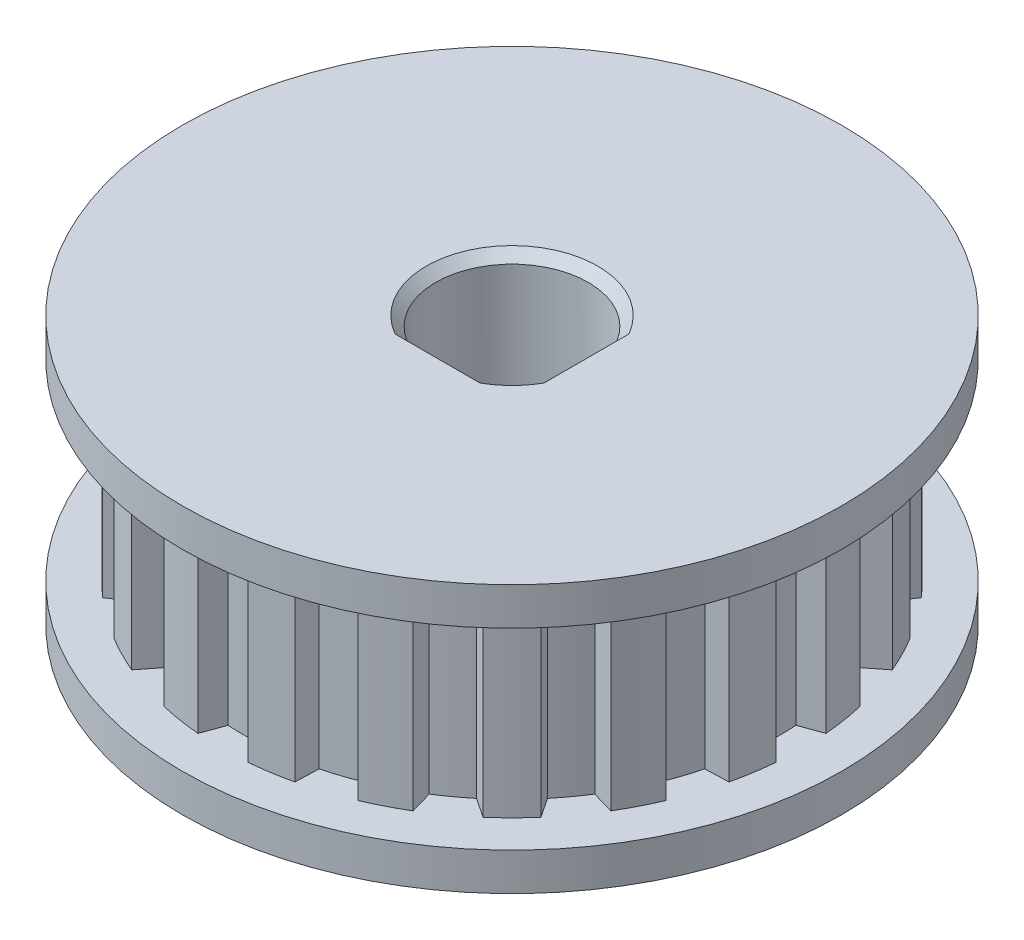
from build123d import *

# Parameters (mm, degrees)
EXTRUDE_1_DEPTH     = 10.2
SKETCH_3_R          = 17.5
EXTRUDE_2_DEPTH     = 2
EXTRUDE_START       = 2
SKETCH_4_R          = 17.5
EXTRUDE_3_DEPTH     = 2
CUT_EXTRUDE_4_DEPTH = 10
CUT_EXTRUDE_START   = -4.2
SKETCH_6_R          = 4.05
CUT_EXTRUDE_5_DEPTH = 4.2
CHAMFER_1_SIZE      = 0.5
CHAMFER_2_SIZE      = 0.5


with BuildPart() as part:
    # Эскиз2 → Вытянуть1 (new body)
    with BuildSketch(Plane(origin=(0, 0, 0), x_dir=(1, 0, 0), z_dir=(0, 1, 0))):
        with BuildLine():
            Line((-0.9, 14.171450173), (-1.326328648, 15.342778507))
            ThreePointArc((-1.326328648, 15.342778507), (-2.409090762, 15.210400445), (-3.479765796, 15.00170757))
            Line((-3.479765796, 15.00170757), (-3.523268074, 13.755965327))
            ThreePointArc((-3.523268074, 13.755965327), (-4.38804132, 13.505002531), (-5.235169803, 13.199734737))
            Line((-5.235169803, 13.199734737), (-6.002592803, 14.181991385))
            ThreePointArc((-6.002592803, 14.181991385), (-6.991453696, 13.721500473), (-7.945236519, 13.192164972))
            Line((-7.945236519, 13.192164972), (-7.60165412, 11.993950752))
            ThreePointArc((-7.60165412, 11.993950752), (-8.346550583, 11.48804132), (-9.05788471, 10.935937298))
            Line((-9.05788471, 10.935937298), (-10.091281352, 11.632972134))
            ThreePointArc((-10.091281352, 11.632972134), (-10.88944443, 10.88944443), (-11.632972134, 10.091281352))
            Line((-11.632972134, 10.091281352), (-10.935937298, 9.05788471))
            ThreePointArc((-10.935937298, 9.05788471), (-11.48804132, 8.346550583), (-11.993950752, 7.60165412))
            Line((-11.993950752, 7.60165412), (-13.192164972, 7.945236519))
            ThreePointArc((-13.192164972, 7.945236519), (-13.721500473, 6.991453696), (-14.181991385, 6.002592803))
            Line((-14.181991385, 6.002592803), (-13.199734737, 5.235169803))
            ThreePointArc((-13.199734737, 5.235169803), (-13.505002531, 4.38804132), (-13.755965327, 3.523268074))
            Line((-13.755965327, 3.523268074), (-15.00170757, 3.479765796))
            ThreePointArc((-15.00170757, 3.479765796), (-15.210400445, 2.409090762), (-15.342778507, 1.326328648))
            Line((-15.342778507, 1.326328648), (-14.171450173, 0.9))
            ThreePointArc((-14.171450173, 0.9), (-14.2, 0), (-14.171450173, -0.9))
            Line((-14.171450173, -0.9), (-15.342778507, -1.326328648))
            ThreePointArc((-15.342778507, -1.326328648), (-15.210400445, -2.409090762), (-15.00170757, -3.479765796))
            Line((-15.00170757, -3.479765796), (-13.755965327, -3.523268074))
            ThreePointArc((-13.755965327, -3.523268074), (-13.505002531, -4.38804132), (-13.199734737, -5.235169803))
            Line((-13.199734737, -5.235169803), (-14.181991385, -6.002592803))
            ThreePointArc((-14.181991385, -6.002592803), (-13.721500473, -6.991453696), (-13.192164972, -7.945236519))
            Line((-13.192164972, -7.945236519), (-11.993950752, -7.60165412))
            ThreePointArc((-11.993950752, -7.60165412), (-11.48804132, -8.346550583), (-10.935937298, -9.05788471))
            Line((-10.935937298, -9.05788471), (-11.632972134, -10.091281352))
            ThreePointArc((-11.632972134, -10.091281352), (-10.88944443, -10.88944443), (-10.091281352, -11.632972134))
            Line((-10.091281352, -11.632972134), (-9.05788471, -10.935937298))
            ThreePointArc((-9.05788471, -10.935937298), (-8.346550583, -11.48804132), (-7.60165412, -11.993950752))
            Line((-7.60165412, -11.993950752), (-7.945236519, -13.192164972))
            ThreePointArc((-7.945236519, -13.192164972), (-6.991453696, -13.721500473), (-6.002592803, -14.181991385))
            Line((-6.002592803, -14.181991385), (-5.235169803, -13.199734737))
            ThreePointArc((-5.235169803, -13.199734737), (-4.38804132, -13.505002531), (-3.523268074, -13.755965327))
            Line((-3.523268074, -13.755965327), (-3.479765796, -15.00170757))
            ThreePointArc((-3.479765796, -15.00170757), (-2.409090762, -15.210400445), (-1.326328648, -15.342778507))
            Line((-1.326328648, -15.342778507), (-0.9, -14.171450173))
            ThreePointArc((-0.9, -14.171450173), (0, -14.2), (0.9, -14.171450173))
            Line((0.9, -14.171450173), (1.326328648, -15.342778507))
            ThreePointArc((1.326328648, -15.342778507), (2.409090762, -15.210400445), (3.479765796, -15.00170757))
            Line((3.479765796, -15.00170757), (3.523268074, -13.755965327))
            ThreePointArc((3.523268074, -13.755965327), (4.38804132, -13.505002531), (5.235169803, -13.199734737))
            Line((5.235169803, -13.199734737), (6.002592803, -14.181991385))
            ThreePointArc((6.002592803, -14.181991385), (6.991453696, -13.721500473), (7.945236519, -13.192164972))
            Line((7.945236519, -13.192164972), (7.60165412, -11.993950752))
            ThreePointArc((7.60165412, -11.993950752), (8.346550583, -11.48804132), (9.05788471, -10.935937298))
            Line((9.05788471, -10.935937298), (10.091281352, -11.632972134))
            ThreePointArc((10.091281352, -11.632972134), (10.88944443, -10.88944443), (11.632972134, -10.091281352))
            Line((11.632972134, -10.091281352), (10.935937298, -9.05788471))
            ThreePointArc((10.935937298, -9.05788471), (11.48804132, -8.346550583), (11.993950752, -7.60165412))
            Line((11.993950752, -7.60165412), (13.192164972, -7.945236519))
            ThreePointArc((13.192164972, -7.945236519), (13.721500473, -6.991453696), (14.181991385, -6.002592803))
            Line((14.181991385, -6.002592803), (13.199734737, -5.235169803))
            ThreePointArc((13.199734737, -5.235169803), (13.505002531, -4.38804132), (13.755965327, -3.523268074))
            Line((13.755965327, -3.523268074), (15.00170757, -3.479765796))
            ThreePointArc((15.00170757, -3.479765796), (15.210400445, -2.409090762), (15.342778507, -1.326328648))
            Line((15.342778507, -1.326328648), (14.171450173, -0.9))
            ThreePointArc((14.171450173, -0.9), (14.2, 0), (14.171450173, 0.9))
            Line((14.171450173, 0.9), (15.342778507, 1.326328648))
            ThreePointArc((15.342778507, 1.326328648), (15.210400445, 2.409090762), (15.00170757, 3.479765796))
            Line((15.00170757, 3.479765796), (13.755965327, 3.523268074))
            ThreePointArc((13.755965327, 3.523268074), (13.505002531, 4.38804132), (13.199734737, 5.235169803))
            Line((13.199734737, 5.235169803), (14.181991385, 6.002592803))
            ThreePointArc((14.181991385, 6.002592803), (13.721500473, 6.991453696), (13.192164972, 7.945236519))
            Line((13.192164972, 7.945236519), (11.993950752, 7.60165412))
            ThreePointArc((11.993950752, 7.60165412), (11.48804132, 8.346550583), (10.935937298, 9.05788471))
            Line((10.935937298, 9.05788471), (11.632972134, 10.091281352))
            ThreePointArc((11.632972134, 10.091281352), (10.88944443, 10.88944443), (10.091281352, 11.632972134))
            Line((10.091281352, 11.632972134), (9.05788471, 10.935937298))
            ThreePointArc((9.05788471, 10.935937298), (8.346550583, 11.48804132), (7.60165412, 11.993950752))
            Line((7.60165412, 11.993950752), (7.945236519, 13.192164972))
            ThreePointArc((7.945236519, 13.192164972), (6.991453696, 13.721500473), (6.002592803, 14.181991385))
            Line((6.002592803, 14.181991385), (5.235169803, 13.199734737))
            ThreePointArc((5.235169803, 13.199734737), (4.38804132, 13.505002531), (3.523268074, 13.755965327))
            Line((3.523268074, 13.755965327), (3.479765796, 15.00170757))
            ThreePointArc((3.479765796, 15.00170757), (2.409090762, 15.210400445), (1.326328648, 15.342778507))
            Line((1.326328648, 15.342778507), (0.9, 14.171450173))
            ThreePointArc((0.9, 14.171450173), (0, 14.2), (-0.9, 14.171450173))
        make_face()
    extrude(amount=EXTRUDE_1_DEPTH)

    # Эскиз3 → Вытянуть2 (add)
    with BuildSketch(Plane(origin=(0, 10.2, 0), x_dir=(1, 0, 0), z_dir=(0, 1, 0))):
        with Locations(Location((0, 0, 0), (0, 0, 270))):
            Circle(SKETCH_3_R)
    extrude(amount=EXTRUDE_2_DEPTH)

    # Эскиз4 → Вытянуть3 (add)
    with BuildSketch(Plane.XZ.offset(EXTRUDE_START)):
        with Locations(Location((0, 0, 0), (0, 0, 90))):
            Circle(SKETCH_4_R)
    extrude(amount=-EXTRUDE_3_DEPTH)

    # Эскиз5 → Вытянуть4 (cut)
    with BuildSketch(Plane(origin=(0, 12.2, 0), x_dir=(1, 0, 0), z_dir=(0, 1, 0))):
        with BuildLine():
            Line((3.45, -2.121320344), (3.45, 2.121320344))
            ThreePointArc((3.45, 2.121320344), (-2.863782464, 2.863782464), (-2.121320344, -3.45))
            Line((-2.121320344, -3.45), (2.121320344, -3.45))
            ThreePointArc((2.121320344, -3.45), (2.863782464, -2.863782464), (3.45, -2.121320344))
        make_face()
    extrude(amount=-CUT_EXTRUDE_4_DEPTH, mode=Mode.SUBTRACT)

    # Эскиз6 → Вытянуть5 (cut)
    with BuildSketch(Plane.XZ.offset(2).offset(CUT_EXTRUDE_START)):
        with Locations(Location((0, 0, 0), (0, 0, 58.413661903))):
            Circle(SKETCH_6_R)
    extrude(amount=CUT_EXTRUDE_5_DEPTH, mode=Mode.SUBTRACT)

    # Фаска1
    chamfer_1_edges = [part.edges().sort_by_distance(p)[0] for p in [
        (-2.863782464, 12.2, -2.863782464),
        (0, 12.2, 3.45),
        (2.863782464, 12.2, 2.863782464),
        (3.45, 12.2, 0),
    ]]
    chamfer(chamfer_1_edges, length=CHAMFER_1_SIZE)

    # Фаска2
    chamfer_2_edges = [part.edges().sort_by_distance(p)[0] for p in [
        (-2.121320344, -2, -3.45),
    ]]
    chamfer(chamfer_2_edges, length=CHAMFER_2_SIZE)


solid = part.part
